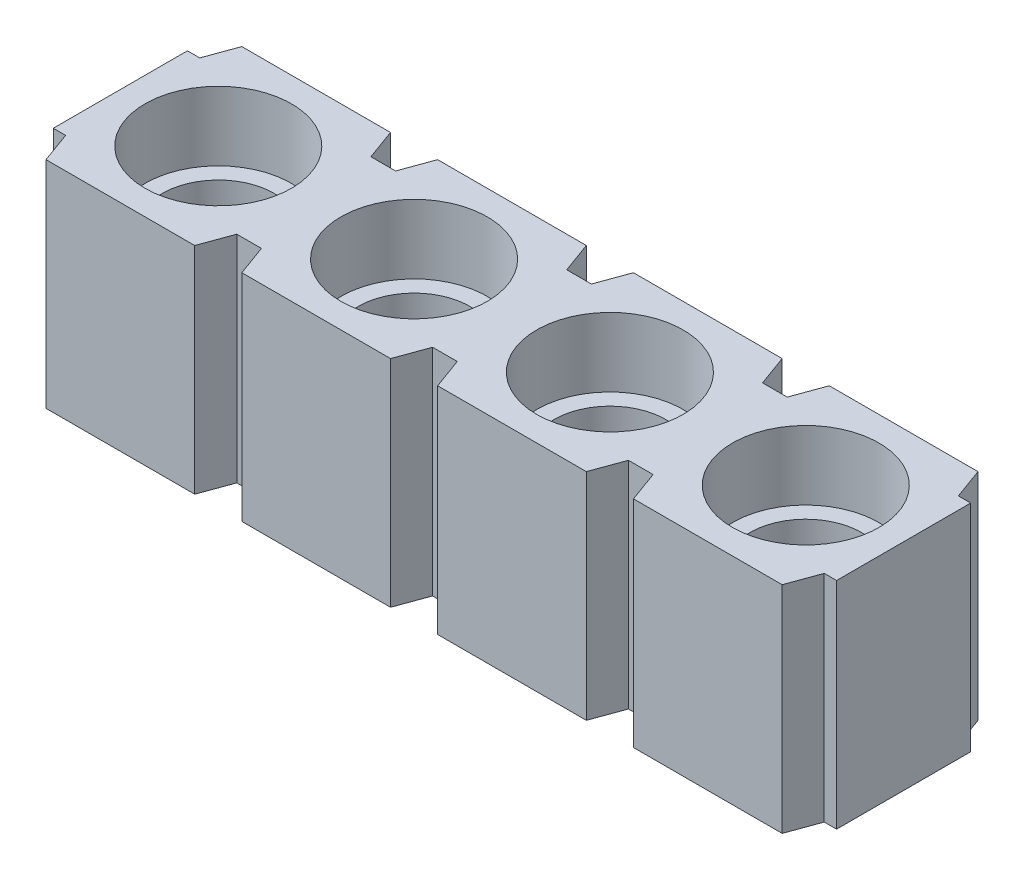
from build123d import *

# Parameters (mm, degrees)
EXTRUDE1_DEPTH    = 2.794
HOLE1_D           = 1.45034
HOLE1_CBORE_D     = 1.89992
HOLE1_CBORE_DEPTH = 0.89408
EXTRUDE2_DEPTH    = 2.794
LPATTERN1_COUNT   = 4
LPATTERN1_PITCH   = 2.54
LPATTERN2_COUNT   = 63
LPATTERN2_PITCH   = 2.54


with BuildPart() as part:
    # Sketch1 → Extrude1 (new body)
    with BuildSketch(Plane(origin=(0, 0, 0), x_dir=(1, 0, 0), z_dir=(0, 1, 0))):
        Polygon((9.854373708, 0.40005), (9.694353708, 0.40005), (9.548747416, 0), (0, 0), (-0.145606292, 0.40005), (-0.305626292, 0.40005), (-0.305626292, 2.13995), (-0.145606292, 2.13995), (0, 2.54), (9.548747416, 2.54), (9.694353708, 2.13995), (9.854373708, 2.13995), align=None)
    extrude(amount=-EXTRUDE1_DEPTH)

    # Hole1 (through all)
    with Locations(Plane(origin=(0.964373708, 0, -1.27), x_dir=(0, 0, 1), z_dir=(0, 1, 0))):
        with Locations((0, 0)):
            hole1 = CounterBoreHole(HOLE1_D / 2, HOLE1_CBORE_D / 2, HOLE1_CBORE_DEPTH)

    # Sketch4 → Extrude2 (cut)
    with BuildSketch(Plane(origin=(0, 0, 0), x_dir=(1, 0, 0), z_dir=(0, 1, 0))):
        Polygon((1.928772816, 0), (2.5399746, 0), (2.394368308, 0.40005), (2.074379108, 0.40005), align=None)
        Polygon((2.074379108, 2.13995), (2.394368308, 2.13995), (2.5399746, 2.54), (1.928772816, 2.54), align=None)
    extrude2 = extrude(amount=-EXTRUDE2_DEPTH, mode=Mode.SUBTRACT)

    # LPattern1: Hole1 ×4
    with Locations(*[(i * LPATTERN1_PITCH, 0, 0) for i in range(1, LPATTERN1_COUNT)]):
        add(hole1, mode=Mode.SUBTRACT)

    # LPattern2: Extrude2 ×63
    with Locations(*[(i * LPATTERN2_PITCH, 0, 0) for i in range(1, LPATTERN2_COUNT)]):
        add(extrude2, mode=Mode.SUBTRACT)


solid = part.part
